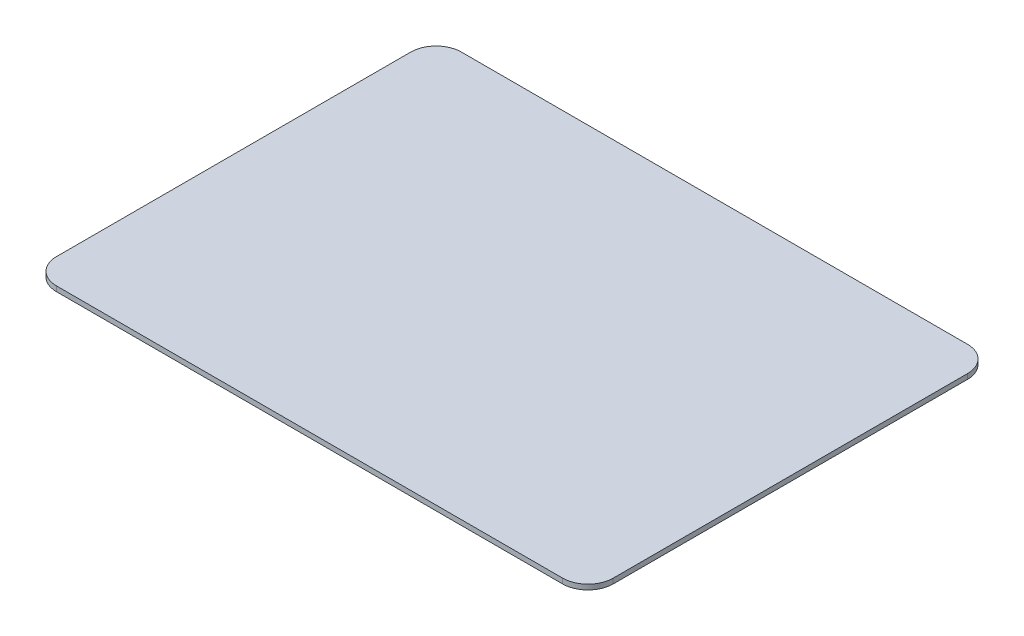
from build123d import *

# Parameters (mm, degrees)
BOSS_EXTRUDE1_DEPTH = 2.54


with BuildPart() as part:
    # Sketch1 → Boss-Extrude1 (new body)
    with BuildSketch(Plane(origin=(0, 0, 0), x_dir=(1, 0, 0), z_dir=(0, 1, 0))):
        with BuildLine():
            Line((-127, -101.6), (127, -101.6))
            ThreePointArc((127, -101.6), (135.980256121, -97.880256121), (139.7, -88.9))
            Line((139.7, -88.9), (139.7, 88.9))
            ThreePointArc((139.7, 88.9), (135.980256121, 97.880256121), (127, 101.6))
            Line((127, 101.6), (-127, 101.6))
            ThreePointArc((-127, 101.6), (-135.980256121, 97.880256121), (-139.7, 88.9))
            Line((-139.7, 88.9), (-139.7, -88.9))
            ThreePointArc((-139.7, -88.9), (-135.980256121, -97.880256121), (-127, -101.6))
        make_face()
    extrude(amount=BOSS_EXTRUDE1_DEPTH)


solid = part.part
